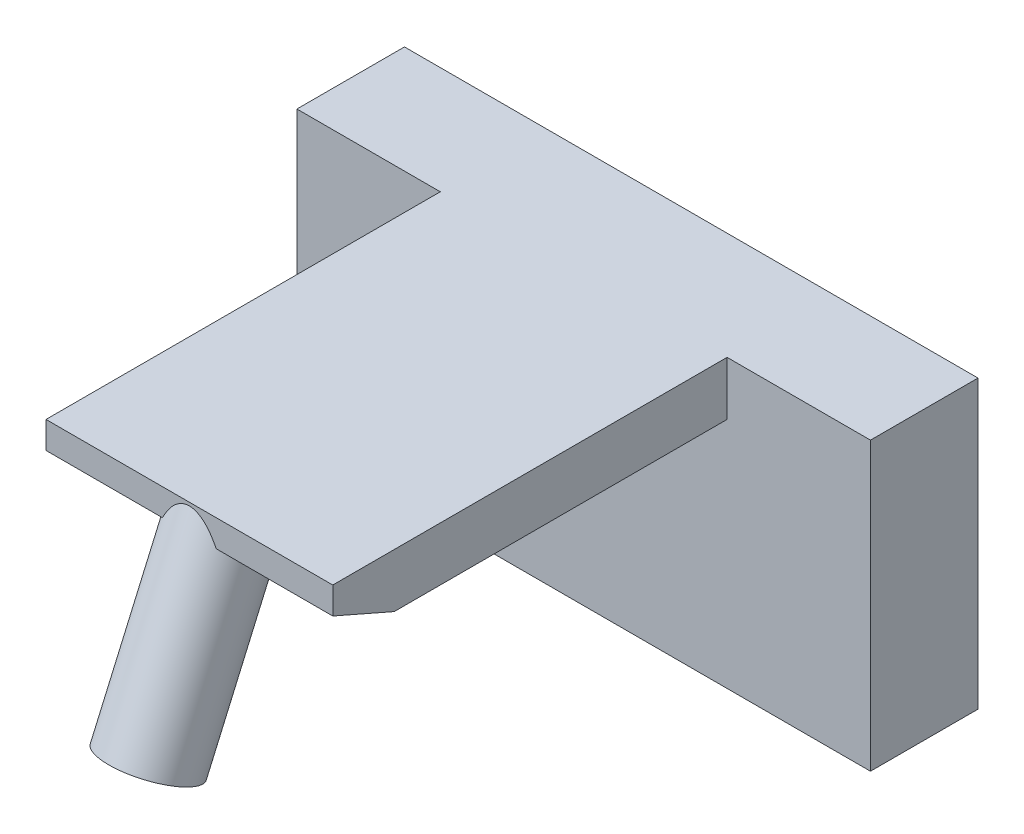
from build123d import *

# Parameters (mm, degrees)
SKETCH1_W                       = 16
SKETCH1_H                       = 8
BOSS_EXTRUDE1_DEPTH             = 3
SHELL3_T                        = -1
SKETCH2_R                       = 1.5
SKETCH2_R_2                     = 0.8
BOSS_EXTRUDE2_DEPTH             = 2
BOSS_EXTRUDE3_DEPTH             = 11
CUT_EXTRUDE2_DEPTH              = 10
SKETCH5_R                       = 1.2
BOSS_EXTRUDE4_DEPTH             = 5
BOSS_EXTRUDE4_DIRECTION_2_REACH = 32.577


with BuildPart() as part:
    # Sketch1 → Boss-Extrude1 (new body)
    with BuildSketch(Plane.XY):
        with Locations((-13.569515058, 18.04477027)):
            Rectangle(SKETCH1_W, SKETCH1_H)
    extrude(amount=BOSS_EXTRUDE1_DEPTH)

    # Shell3
    shell3_openings = [part.faces().sort_by_distance(p)[0] for p in [
        (-13.569515058, 18.04477027, 0),
    ]]
    offset(amount=SHELL3_T, openings=shell3_openings, kind=Kind.INTERSECTION)

    # Sketch2 → Boss-Extrude2 (add)
    with BuildSketch(Plane(origin=(0, 0, 2), x_dir=(-1, 0, 0), z_dir=(0, 0, -1))):
        with Locations((13.569515058, 18.04477027)):
            Circle(SKETCH2_R)
        with Locations((13.569515058, 18.04477027)):
            Circle(SKETCH2_R_2, mode=Mode.SUBTRACT)
    extrude(amount=BOSS_EXTRUDE2_DEPTH)

    # Sketch3 → Boss-Extrude3 (add)
    with BuildSketch(Plane.XY.offset(3)):
        with BuildLine():
            Line((-17.569515058, 22.04477027), (-17.569515058, 20.54477027))
            Line((-17.569515058, 20.54477027), (-15.569515058, 20.54477027))
            ThreePointArc((-15.569515058, 20.54477027), (-13.569515058, 19.54477027), (-11.569515058, 20.54477027))
            Line((-11.569515058, 20.54477027), (-9.569515058, 20.54477027))
            Line((-9.569515058, 20.54477027), (-9.569515058, 22.04477027))
            Line((-9.569515058, 22.04477027), (-17.569515058, 22.04477027))
        make_face()
    extrude(amount=BOSS_EXTRUDE3_DEPTH)

    # Sketch4 → Cut-Extrude2 (cut)
    with BuildSketch(Plane.ZY.offset(17.569515058)):
        Polygon((14, 21.29477027), (14, 19.54477027), (10, 19.54477027), align=None)
    extrude(amount=-CUT_EXTRUDE2_DEPTH, mode=Mode.SUBTRACT)

    # Sketch5 → Boss-Extrude4 (add)
    with BuildSketch(Plane(origin=(0, 12.732659637, -5.570538591), x_dir=(-1, 0, 0), z_dir=(0, -0.9161573349021893, 0.4008188340197074))):
        with Locations(Location((13.569515058, -20.425962901, 0), (0, 0, 90))):
            Circle(SKETCH5_R)
    extrude(amount=BOSS_EXTRUDE4_DEPTH)

    # Sketch5 → Boss-Extrude4 direction 2 (add, up to next)
    with BuildSketch(Plane(origin=(0, 12.732659637, -5.570538591), x_dir=(-1, 0, 0), z_dir=(0, -0.9161573349021893, 0.4008188340197074)), mode=Mode.PRIVATE) as boss_extrude4_direction_2_sk1:
        with Locations(Location((13.569515058, -20.425962901, 0), (0, 0, 90))):
            Circle(SKETCH5_R)
    boss_extrude4_direction_2_tool1 = extrude(boss_extrude4_direction_2_sk1.sketch, amount=-BOSS_EXTRUDE4_DIRECTION_2_REACH, mode=Mode.PRIVATE) - part.part
    add(boss_extrude4_direction_2_tool1.solids().sort_by_distance((-13.569515, 20.91977, 13.142857))[0])


solid = part.part
